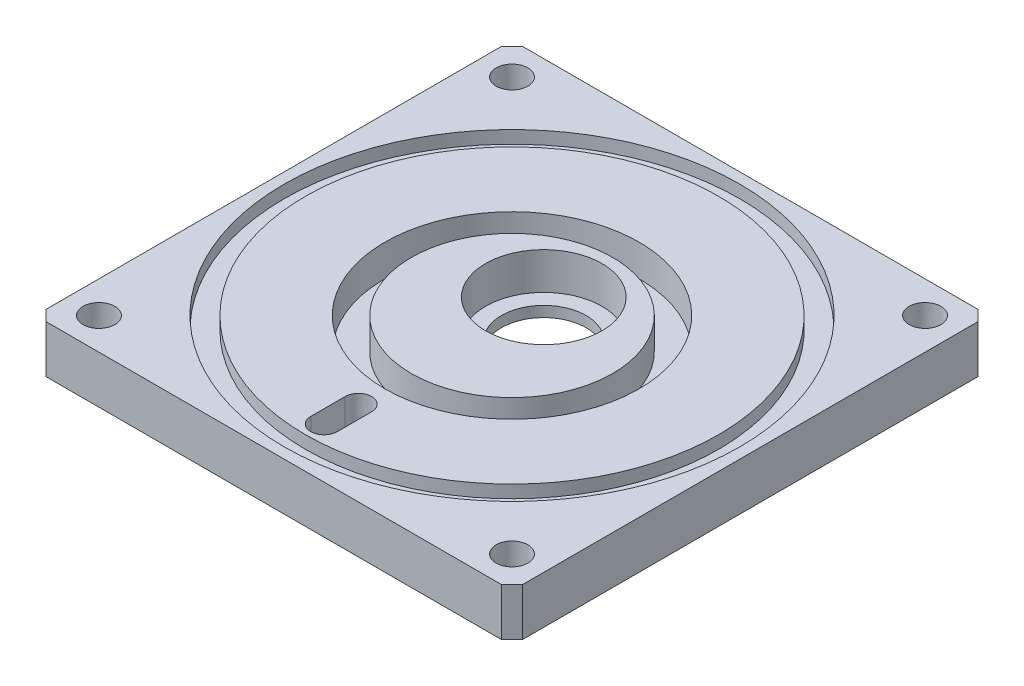
from build123d import *

# Parameters (mm, degrees)
SKETCH_1_W          = 45
SKETCH_1_H          = 45
EXTRUDE_1_DEPTH     = 4.5
SKETCH_2_R          = 5.5
CUT_EXTRUDE_1_DEPTH = 3.5
SKETCH_3_R          = 4
CUT_EXTRUDE_2_DEPTH = 33.011716605
SKETCH_4_R          = 12
SKETCH_4_R_2        = 9.5
CUT_EXTRUDE_3_DEPTH = 3
SKETCH_5_R          = 21.5
SKETCH_5_R_2        = 19.5
CUT_EXTRUDE_4_DEPTH = 1.2
CUT_EXTRUDE_5_DEPTH = 33.136427928
SKETCH_8_R          = 1.5
CUT_EXTRUDE_6_DEPTH = 33.136427928
CHAMFER_1_SIZE      = 1


with BuildPart() as part:
    # 草图1 → 凸台-拉伸1 (new body)
    with BuildSketch(Plane(origin=(0, 0, 0), x_dir=(1, 0, 0), z_dir=(0, 1, 0))):
        Rectangle(SKETCH_1_W, SKETCH_1_H)
    extrude(amount=EXTRUDE_1_DEPTH)

    # 草图2 → 切除-拉伸1 (cut)
    with BuildSketch(Plane(origin=(0, 4.5, 0), x_dir=(1, 0, 0), z_dir=(0, 1, 0))):
        with Locations(Location((0, 3, 0), (0, 0, 270))):
            Circle(SKETCH_2_R)
    extrude(amount=-CUT_EXTRUDE_1_DEPTH, mode=Mode.SUBTRACT)

    # 草图3 → 切除-拉伸2 (cut, through all)
    with BuildSketch(Plane(origin=(0, 1, 0), x_dir=(1, 0, 0), z_dir=(0, 1, 0))):
        with Locations(Location((0, 3, 0), (0, 0, 270))):
            Circle(SKETCH_3_R)
    extrude(amount=-CUT_EXTRUDE_2_DEPTH, mode=Mode.SUBTRACT)

    # 草图4 → 切除-拉伸3 (cut)
    with BuildSketch(Plane(origin=(0, 4.5, 0), x_dir=(1, 0, 0), z_dir=(0, 1, 0))):
        with Locations(Location((0, 0, 0), (0, 0, 270))):
            Circle(SKETCH_4_R)
        with Locations(Location((0, 0, 0), (0, 0, 270))):
            Circle(SKETCH_4_R_2, mode=Mode.SUBTRACT)
    extrude(amount=-CUT_EXTRUDE_3_DEPTH, mode=Mode.SUBTRACT)

    # 草图5 → 切除-拉伸4 (cut)
    with BuildSketch(Plane(origin=(0, 4.5, 0), x_dir=(1, 0, 0), z_dir=(0, 1, 0))):
        with Locations(Location((0, 0, 0), (0, 0, 270))):
            Circle(SKETCH_5_R)
        with Locations(Location((0, 0, 0), (0, 0, 270))):
            Circle(SKETCH_5_R_2, mode=Mode.SUBTRACT)
    extrude(amount=-CUT_EXTRUDE_4_DEPTH, mode=Mode.SUBTRACT)

    # 草图6 → 切除-拉伸5 (cut, through all)
    with BuildSketch(Plane(origin=(0, 4.5, 0), x_dir=(1, 0, 0), z_dir=(0, 1, 0))):
        with BuildLine():
            Line((1.25, -14.5), (1.25, -17.75))
            ThreePointArc((1.25, -17.75), (0, -19), (-1.25, -17.75))
            Line((-1.25, -17.75), (-1.25, -14.5))
            ThreePointArc((-1.25, -14.5), (0, -13.25), (1.25, -14.5))
        make_face()
    extrude(amount=-CUT_EXTRUDE_5_DEPTH, mode=Mode.SUBTRACT)

    # 草图8 → 切除-拉伸6 (cut, through all)
    with BuildSketch(Plane.XZ):
        with Locations(Location((-19.5, 19.5, 0), (0, 0, 270))):
            Circle(SKETCH_8_R)
        with Locations(Location((19.5, 19.5, 0), (0, 0, 90))):
            Circle(SKETCH_8_R)
        with Locations(Location((19.5, -19.5, 0), (0, 0, 270))):
            Circle(SKETCH_8_R)
        with Locations(Location((-19.5, -19.5, 0), (0, 0, 90))):
            Circle(SKETCH_8_R)
    extrude(amount=-CUT_EXTRUDE_6_DEPTH, mode=Mode.SUBTRACT)

    # 倒角1
    chamfer_1_edges = [part.edges().sort_by_distance(p)[0] for p in [
        (22.5, 2.25, 22.5),
        (-22.5, 2.25, 22.5),
        (-22.5, 2.25, -22.5),
        (22.5, 2.25, -22.5),
    ]]
    chamfer(chamfer_1_edges, length=CHAMFER_1_SIZE)


solid = part.part
